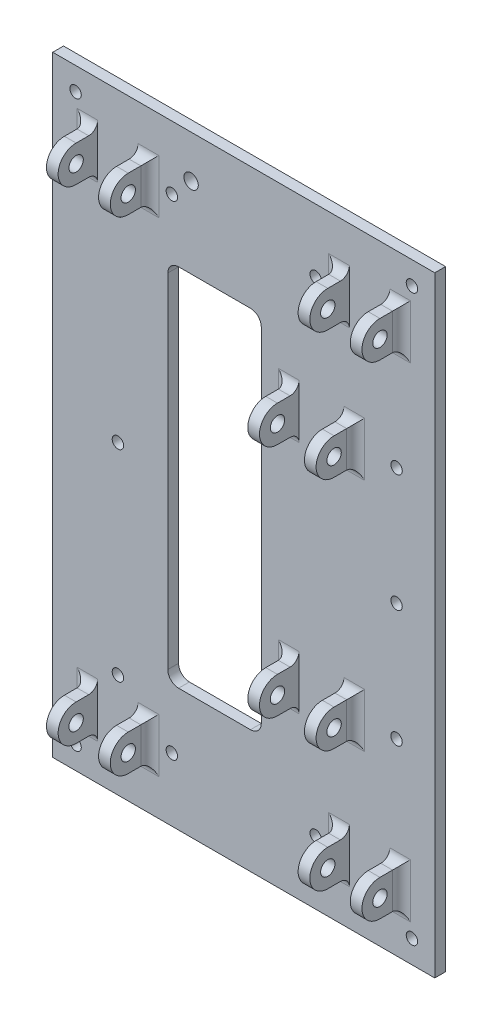
from build123d import *

# Parameters (mm, degrees)
SKETCH1_W               = 212.5
SKETCH1_H               = 339.725
BOSS_EXTRUDE1_DEPTH     = 6
SKETCH2_W               = 6.5
SKETCH2_H               = 20
BOSS_EXTRUDE2_DEPTH     = 24
CUT_EXTRUDE1_DEPTH      = 393.36344838
CUT_EXTRUDE1_DEPTH_BACK = 393.36344838
SKETCH3_R               = 4
FILLET2_R               = 5
SKETCH5_R               = 3.175
CUT_EXTRUDE2_DEPTH      = 402.314497153
CUT_EXTRUDE3_DEPTH      = 402.314497153
SKETCH10_R              = 4
CUT_EXTRUDE4_DEPTH      = 18
SKETCH11_R              = 4
CUT_EXTRUDE5_DEPTH      = 14.986


with BuildPart() as part:
    # Sketch1 → Boss-Extrude1 (new body)
    with BuildSketch(Plane.XY):
        with Locations((106.25, -169.8625)):
            Rectangle(SKETCH1_W, SKETCH1_H)
    extrude(amount=BOSS_EXTRUDE1_DEPTH)

    # Sketch2 → Boss-Extrude2 (add)
    with BuildSketch(Plane.XY.offset(6)):
        with Locations((21.75, -35.2425)):
            Rectangle(SKETCH2_W, SKETCH2_H)
        with Locations((50.75, -35.2425)):
            Rectangle(SKETCH2_W, SKETCH2_H)
        with Locations((161.75, -35.2425)):
            Rectangle(SKETCH2_W, SKETCH2_H)
        with Locations((190.75, -35.2425)):
            Rectangle(SKETCH2_W, SKETCH2_H)
        with Locations((133.75, -104.5325)):
            Rectangle(SKETCH2_W, SKETCH2_H)
        with Locations((165.25, -104.5325)):
            Rectangle(SKETCH2_W, SKETCH2_H)
        with Locations((165.25, -235.1925)):
            Rectangle(SKETCH2_W, SKETCH2_H)
        with Locations((21.75, -304.4825)):
            Rectangle(SKETCH2_W, SKETCH2_H)
        with Locations((50.75, -304.4825)):
            Rectangle(SKETCH2_W, SKETCH2_H)
        with Locations((190.75, -304.4825)):
            Rectangle(SKETCH2_W, SKETCH2_H)
        with Locations((161.75, -304.4825)):
            Rectangle(SKETCH2_W, SKETCH2_H)
        with Locations((133.75, -235.1925)):
            Rectangle(SKETCH2_W, SKETCH2_H)
    extrude(amount=BOSS_EXTRUDE2_DEPTH)

    # Sketch3 → Cut-Extrude1 (cut, two sides: drawn at the far end of the back side and taken through both)
    with BuildSketch(Plane.ZY.offset(-18.5).offset(-CUT_EXTRUDE1_DEPTH_BACK)):
        with Locations((18, -35.2425)):
            Circle(SKETCH3_R)
        with Locations((18, -235.1925)):
            Circle(SKETCH3_R)
        with Locations((18, -304.4825)):
            Circle(SKETCH3_R)
        with Locations((18, -104.5325)):
            Circle(SKETCH3_R)
        with BuildLine():
            Line((18, -25.2425), (18, -12.982943413))
            Line((18, -12.982943413), (51.949532367, -12.982943413))
            Line((51.949532367, -12.982943413), (51.949532367, -57.481006387))
            Line((51.949532367, -57.481006387), (18, -57.481006387))
            Line((18, -57.481006387), (18, -45.2425))
            ThreePointArc((18, -45.2425), (28, -35.2425), (18, -25.2425))
        make_face()
        with BuildLine():
            Line((52.442304634, -132.399123951), (18, -132.399123951))
            Line((18, -132.399123951), (18, -114.5325))
            ThreePointArc((18, -114.5325), (28, -104.5325), (18, -94.5325))
            Line((18, -94.5325), (18, -71.59149594))
            Line((18, -71.59149594), (52.442304634, -71.59149594))
            Line((52.442304634, -71.59149594), (52.442304634, -132.399123951))
        make_face()
        with BuildLine():
            Line((52.599532243, -270.375386727), (18, -270.375386727))
            Line((18, -270.375386727), (18, -245.1925))
            ThreePointArc((18, -245.1925), (28, -235.1925), (18, -225.1925))
            Line((18, -225.1925), (18, -207.306351849))
            Line((18, -207.306351849), (52.599532243, -207.306351849))
            Line((52.599532243, -207.306351849), (52.599532243, -270.375386727))
        make_face()
        with BuildLine():
            Line((52.621034016, -326.721115515), (18, -326.721115515))
            Line((18, -326.721115515), (18, -314.4825))
            ThreePointArc((18, -314.4825), (28, -304.4825), (18, -294.4825))
            Line((18, -294.4825), (18, -282.222834285))
            Line((18, -282.222834285), (52.621034016, -282.222834285))
            Line((52.621034016, -282.222834285), (52.621034016, -326.721115515))
        make_face()
    extrude(amount=CUT_EXTRUDE1_DEPTH + CUT_EXTRUDE1_DEPTH_BACK, mode=Mode.SUBTRACT)

    # Fillet2
    fillet2_edges = [part.edges().sort_by_distance(p)[0] for p in [
        (158.5, -304.4825, 6),
        (18.5, -304.4825, 6),
        (21.75, -45.2425, 6),
        (18.5, -35.2425, 6),
        (21.75, -25.2425, 6),
        (50.75, -25.2425, 6),
        (50.75, -45.2425, 6),
        (54, -35.2425, 6),
        (161.75, -25.2425, 6),
        (190.75, -25.2425, 6),
        (194, -35.2425, 6),
        (190.75, -45.2425, 6),
        (161.75, -45.2425, 6),
        (158.5, -35.2425, 6),
        (168.5, -104.5325, 6),
        (165.25, -114.5325, 6),
        (133.75, -114.5325, 6),
        (130.5, -104.5325, 6),
        (165.25, -94.5325, 6),
        (133.75, -94.5325, 6),
        (21.75, -294.4825, 6),
        (50.75, -294.4825, 6),
        (54, -304.4825, 6),
        (194, -304.4825, 6),
        (161.75, -294.4825, 6),
        (190.75, -294.4825, 6),
        (190.75, -314.4825, 6),
        (161.75, -314.4825, 6),
        (50.75, -314.4825, 6),
        (21.75, -314.4825, 6),
        (165.25, -225.1925, 6),
        (133.75, -225.1925, 6),
        (130.5, -235.1925, 6),
        (133.75, -245.1925, 6),
        (165.25, -245.1925, 6),
        (168.5, -235.1925, 6),
    ]]
    fillet(fillet2_edges, radius=FILLET2_R)

    # Sketch5 → Cut-Extrude2 (cut, through all)
    with BuildSketch(Plane.XY.offset(6)):
        with Locations((12.7, -12.7)):
            Circle(SKETCH5_R)
        with Locations((199.8, -12.7)):
            Circle(SKETCH5_R)
        with Locations((66.25, -35.2425)):
            Circle(SKETCH5_R)
        with Locations((146.25, -35.2425)):
            Circle(SKETCH5_R)
        with Locations((176.25, -57.8625)):
            Circle(SKETCH5_R)
        with Locations((36.25, -57.8625)):
            Circle(SKETCH5_R)
        with Locations((191.25, -104.5325)):
            Circle(SKETCH5_R)
        with Locations((36.25, -169.8625)):
            Circle(SKETCH5_R)
        with Locations((191.25, -169.8625)):
            Circle(SKETCH5_R)
        with Locations((36.25, -281.8625)):
            Circle(SKETCH5_R)
        with Locations((66.25, -304.4825)):
            Circle(SKETCH5_R)
        with Locations((12.7, -327.025)):
            Circle(SKETCH5_R)
        with Locations((199.8, -327.025)):
            Circle(SKETCH5_R)
        with Locations((146.25, -304.4825)):
            Circle(SKETCH5_R)
        with Locations((191.25, -235.1925)):
            Circle(SKETCH5_R)
    extrude(amount=-CUT_EXTRUDE2_DEPTH, mode=Mode.SUBTRACT)

    # Sketch9 → Cut-Extrude3 (cut, through all)
    with BuildSketch(Plane.XY.offset(6)):
        with BuildLine():
            ThreePointArc((64, -265.3625), (65.757359313, -269.605140687), (70, -271.3625))
            Line((70, -271.3625), (110, -271.3625))
            ThreePointArc((110, -271.3625), (114.242640687, -269.605140687), (116, -265.3625))
            Line((116, -265.3625), (116, -74.3625))
            ThreePointArc((116, -74.3625), (114.242640687, -70.119859313), (110, -68.3625))
            Line((110, -68.3625), (70, -68.3625))
            ThreePointArc((70, -68.3625), (65.757359313, -70.119859313), (64, -74.3625))
            Line((64, -74.3625), (64, -265.3625))
        make_face()
    extrude(amount=-CUT_EXTRUDE3_DEPTH, mode=Mode.SUBTRACT)

    # Sketch10 → Cut-Extrude4 (cut)
    with BuildSketch(Plane.XY.offset(6)):
        with Locations((180.4781588, -317.559819408)):
            Circle(SKETCH10_R)
    extrude(amount=-CUT_EXTRUDE4_DEPTH, mode=Mode.SUBTRACT)

    # Sketch11 → Cut-Extrude5 (cut)
    with BuildSketch(Plane.XY.offset(6)):
        with Locations((76.9625, -23.613540107)):
            Circle(SKETCH11_R)
    extrude(amount=-CUT_EXTRUDE5_DEPTH, mode=Mode.SUBTRACT)


solid = part.part
